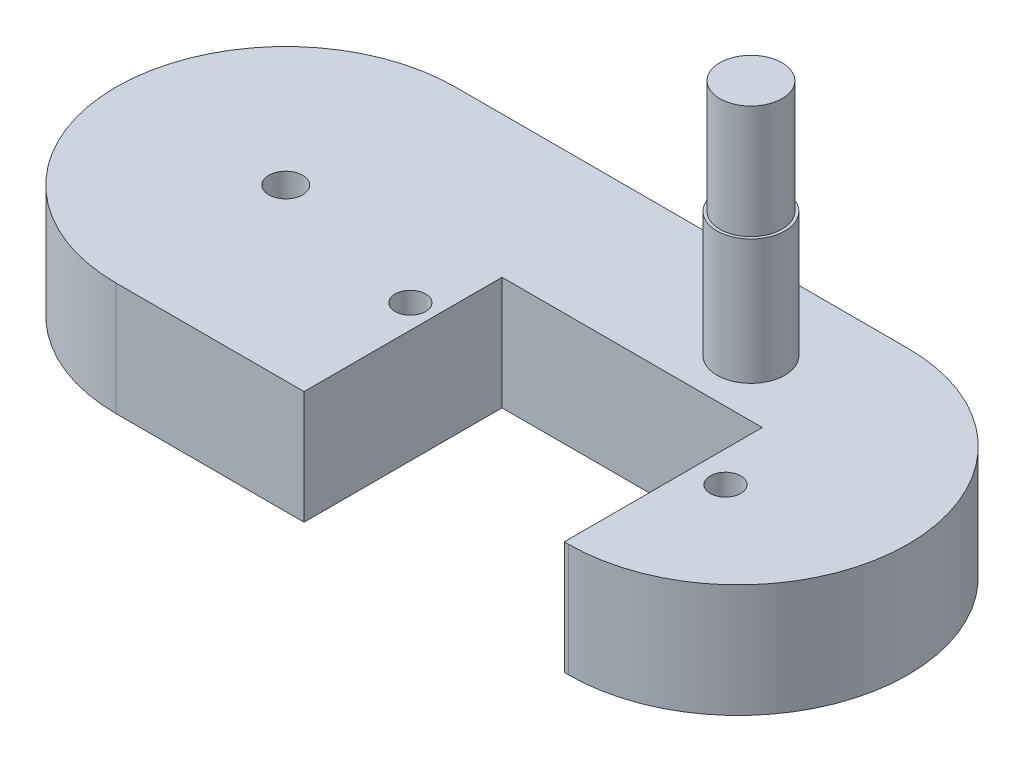
from build123d import *

# Parameters (mm, degrees)
SKETCH2_R            = 1.5
SKETCH2_R_2          = 1.35
BOSS_EXTRUDE5_DEPTH  = 10
SKETCH6_R            = 3
BOSS_EXTRUDE11_DEPTH = 24.05
SKETCH12_OUTSIDE_W   = 88.684
SKETCH12_OUTSIDE_H   = 48.684
SKETCH12_OUTSIDE_R   = 2.75
CUT_EXTRUDE10_DEPTH  = 13
SKETCH13_R           = 2.75
CUT_EXTRUDE11_DEPTH  = 3


with BuildPart() as part:
    # Sketch2 → Boss-Extrude5 (new body)
    with BuildSketch(Plane(origin=(0, 0, 0), x_dir=(1, 0, 0), z_dir=(0, 1, 0))):
        with BuildLine():
            Line((0, 15), (40, 15))
            ThreePointArc((40, 15), (55, 0), (40, -15))
            Line((40, -15), (39.620269747, -15))
            Line((39.620269747, -15), (39.620269747, -10))
            Line((39.620269747, -10), (39.620269747, 2.5))
            Line((39.620269747, 2.5), (16.620269747, 2.5))
            Line((16.620269747, 2.5), (16.620269747, -10))
            Line((16.620269747, -10), (16.620269747, -15))
            Line((16.620269747, -15), (0, -15))
            ThreePointArc((0, -15), (-15, 0), (0, 15))
        make_face()
        with Locations(Location((0, 0, 0), (0, 0, 270))):
            Circle(SKETCH2_R, mode=Mode.SUBTRACT)
        with Locations(Location((42.370269747, -3.5, 0), (0, 0, 270))):
            Circle(SKETCH2_R_2, mode=Mode.SUBTRACT)
        with Locations(Location((14.520269747, -3.5, 0), (0, 0, 270))):
            Circle(SKETCH2_R_2, mode=Mode.SUBTRACT)
    extrude(amount=BOSS_EXTRUDE5_DEPTH)

    # Sketch6 → Boss-Extrude11 (add)
    with BuildSketch(Plane(origin=(0, 10, 0), x_dir=(1, 0, 0), z_dir=(0, 1, 0))):
        with Locations(Location((33.620269747, 7.5, 0), (0, 0, 270))):
            Circle(SKETCH6_R)
    extrude(amount=BOSS_EXTRUDE11_DEPTH)

    # Sketch12 outside → Cut-Extrude10 (cut)
    with BuildSketch(Plane(origin=(0, 34.05, 0), x_dir=(1, 0, 0), z_dir=(0, 1, 0))):
        with Locations((20, 0)):
            Rectangle(SKETCH12_OUTSIDE_W, SKETCH12_OUTSIDE_H)
        with Locations(Location((33.620269747, 7.5, 0), (0, 0, 270))):
            Circle(SKETCH12_OUTSIDE_R, mode=Mode.SUBTRACT)
    extrude(amount=-CUT_EXTRUDE10_DEPTH, mode=Mode.SUBTRACT)

    # Sketch13 → Cut-Extrude11 (cut)
    with BuildSketch(Plane(origin=(0, 34.05, 0), x_dir=(1, 0, 0), z_dir=(0, 1, 0))):
        with Locations(Location((33.620269747, 7.5, 0), (0, 0, 270))):
            Circle(SKETCH13_R)
    extrude(amount=-CUT_EXTRUDE11_DEPTH, mode=Mode.SUBTRACT)


solid = part.part
